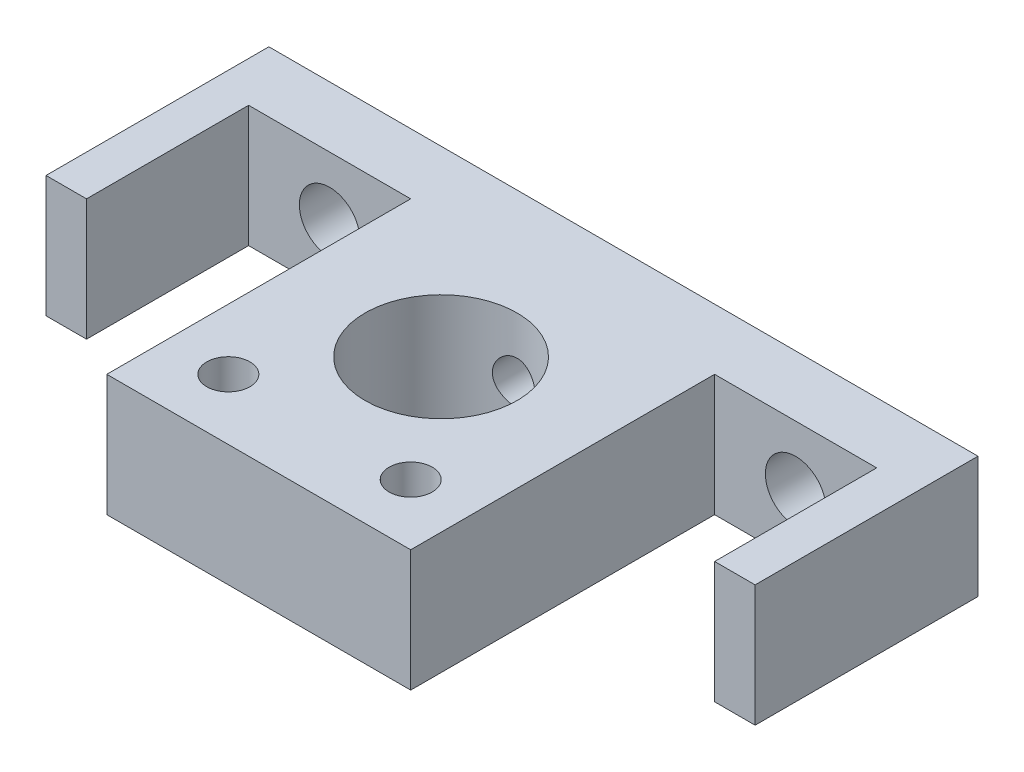
from build123d import *

# Parameters (mm, degrees)
SKETCH1_W                  = 44.45
SKETCH1_H                  = 22.86
SKETCH1_R                  = 4.7625
BOSS_EXTRUDE1_DEPTH        = 7.62
F_6_32_TAPPED_HOLE1_REACH  = 34.781
F_6_32_TAPPED_HOLE1_BORE_R = 1.35255
CUT_EXTRUDE2_REACH         = 28.128
SKETCH19_W                 = 12.7
SKETCH19_H                 = 19.05
F_6_CLEARANCE_HOLE1_D      = 3.7973
SKETCH24_W                 = 2.54
SKETCH24_H                 = 7.62
BOSS_EXTRUDE2_DEPTH        = 10.16
F_6_32_TAPPED_HOLE5_D      = 2.7051


with BuildPart() as part:
    # Sketch1 → Boss-Extrude1 (new body)
    with BuildSketch(Plane(origin=(0, 0, 0), x_dir=(1, 0, 0), z_dir=(0, 1, 0))):
        Rectangle(SKETCH1_W, SKETCH1_H)
        with Locations(Location((0, 0, 0), (0, 0, 90))):
            Circle(SKETCH1_R, mode=Mode.SUBTRACT)
    extrude(amount=BOSS_EXTRUDE1_DEPTH)

    # #6-32 Tapped Hole1 bore → #6-32 Tapped Hole1 (cut, up to next)
    with BuildSketch(Plane(origin=(0, 0, -11.43), x_dir=(-1, 0, 0), z_dir=(0, 0, -1)), mode=Mode.PRIVATE) as f_6_32_tapped_hole1_sk1:
        with Locations((0, 3.81)):
            Circle(F_6_32_TAPPED_HOLE1_BORE_R)
    f_6_32_tapped_hole1_tool1 = extrude(f_6_32_tapped_hole1_sk1.sketch, amount=-F_6_32_TAPPED_HOLE1_REACH, mode=Mode.PRIVATE) & part.part
    add(f_6_32_tapped_hole1_tool1.solids().sort_by_distance((0, 3.81, -11.43))[0], mode=Mode.SUBTRACT)

    # Sketch19 → Cut-Extrude2 (cut, up to next)
    with BuildSketch(Plane(origin=(0, 7.62, 0), x_dir=(1, 0, 0), z_dir=(0, 1, 0)), mode=Mode.PRIVATE) as cut_extrude2_sk1:
        with Locations((-15.875, -1.905)):
            Rectangle(SKETCH19_W, SKETCH19_H)
    cut_extrude2_tool1 = extrude(cut_extrude2_sk1.sketch, amount=-CUT_EXTRUDE2_REACH, mode=Mode.PRIVATE) & part.part
    cut_extrude2 = cut_extrude2_tool1.solids().sort_by_distance((-15.875, 7.62, 1.905))[0]
    add(cut_extrude2, mode=Mode.SUBTRACT)

    # #6 Clearance Hole1 (through all)
    with Locations(Plane.XY.offset(-7.62)):
        with Locations((-14.605, 3.81)):
            f_6_clearance_hole1 = Hole(F_6_CLEARANCE_HOLE1_D / 2)

    # Mirror4: Cut-Extrude2, #6 Clearance Hole1 across plane
    add(cut_extrude2.mirror(Plane(origin=(0, 0, 0), x_dir=(0, 0, 1), z_dir=(1, 0, 0))), mode=Mode.SUBTRACT)
    add(f_6_clearance_hole1.mirror(Plane(origin=(0, 0, 0), x_dir=(0, 0, 1), z_dir=(1, 0, 0))), mode=Mode.SUBTRACT)

    # Sketch24 → Boss-Extrude2 (add)
    with BuildSketch(Plane.XY.offset(-7.62)):
        with Locations((-20.955, 3.81)):
            Rectangle(SKETCH24_W, SKETCH24_H)
    boss_extrude2 = extrude(amount=BOSS_EXTRUDE2_DEPTH)

    # Mirror5: Boss-Extrude2 across plane
    add(boss_extrude2.mirror(Plane(origin=(0, 0, 0), x_dir=(0, 0, 1), z_dir=(1, 0, 0))))

    # #6-32 Tapped Hole5 (through all)
    with Locations(Plane(origin=(0, 7.62, 0), x_dir=(1, 0, 0), z_dir=(0, 1, 0))):
        with Locations((-5.715, -7.62), (5.715, -7.62)):
            Hole(F_6_32_TAPPED_HOLE5_D / 2)


solid = part.part
